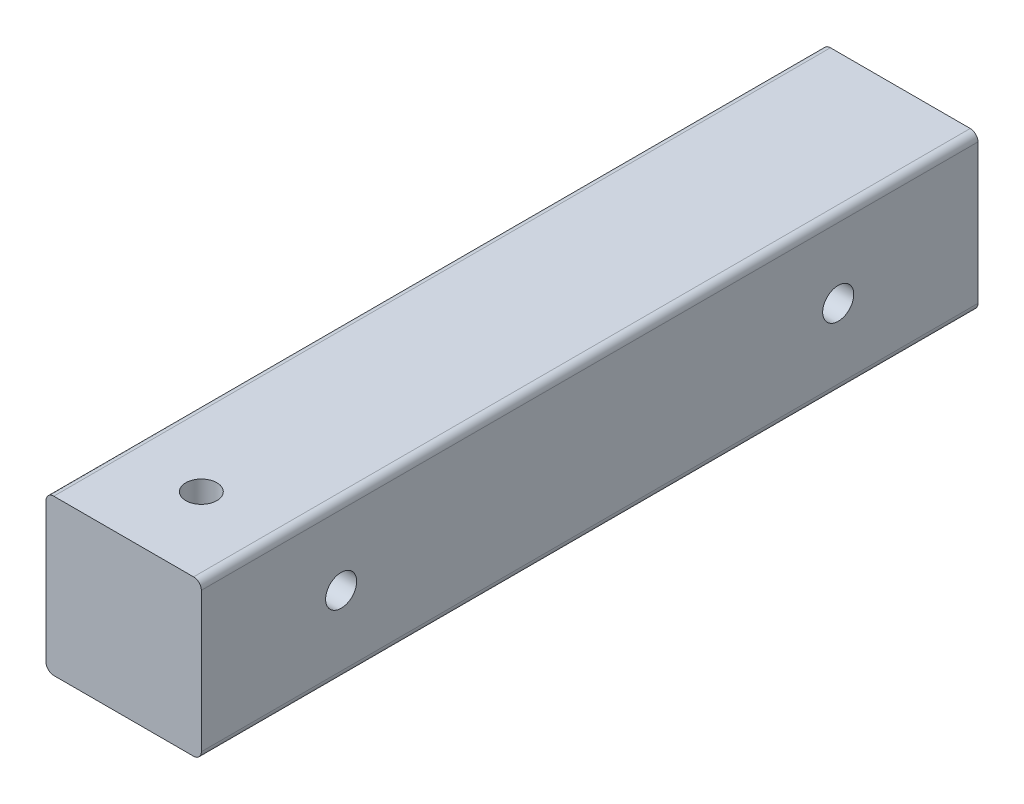
from build123d import *

# Parameters (mm, degrees)
SKETCH_1_W          = 20
SKETCH_1_H          = 20
EXTRUDE_1_DEPTH     = 100
SKETCH_2_R          = 2
CUT_EXTRUDE_1_DEPTH = 20
SKETCH_3_R          = 2
CUT_EXTRUDE_2_DEPTH = 20
FILLET_1_R          = 1


with BuildPart() as part:
    # 草图1 → 凸台-拉伸1 (new body)
    with BuildSketch(Plane.XY):
        with Locations((10, 10)):
            Rectangle(SKETCH_1_W, SKETCH_1_H)
    extrude(amount=EXTRUDE_1_DEPTH)

    # 草图2 → 切除-拉伸1 (cut)
    with BuildSketch(Plane(origin=(20, 0, 0), x_dir=(0, 0, -1), z_dir=(1, 0, 0))):
        with Locations((-18, 10)):
            Circle(SKETCH_2_R)
        with Locations((-82, 10)):
            Circle(SKETCH_2_R)
    extrude(amount=-CUT_EXTRUDE_1_DEPTH, mode=Mode.SUBTRACT)

    # 草图3 → 切除-拉伸2 (cut)
    with BuildSketch(Plane.XZ):
        with Locations(Location((10, 90, 0), (0, 0, 270))):
            Circle(SKETCH_3_R)
    extrude(amount=-CUT_EXTRUDE_2_DEPTH, mode=Mode.SUBTRACT)

    # 圆角1
    fillet_1_edges = [part.edges().sort_by_distance(p)[0] for p in [
        (0, 20, 50),
        (20, 20, 50),
        (20, 0, 50),
        (0, 0, 50),
    ]]
    fillet(fillet_1_edges, radius=FILLET_1_R)


solid = part.part
